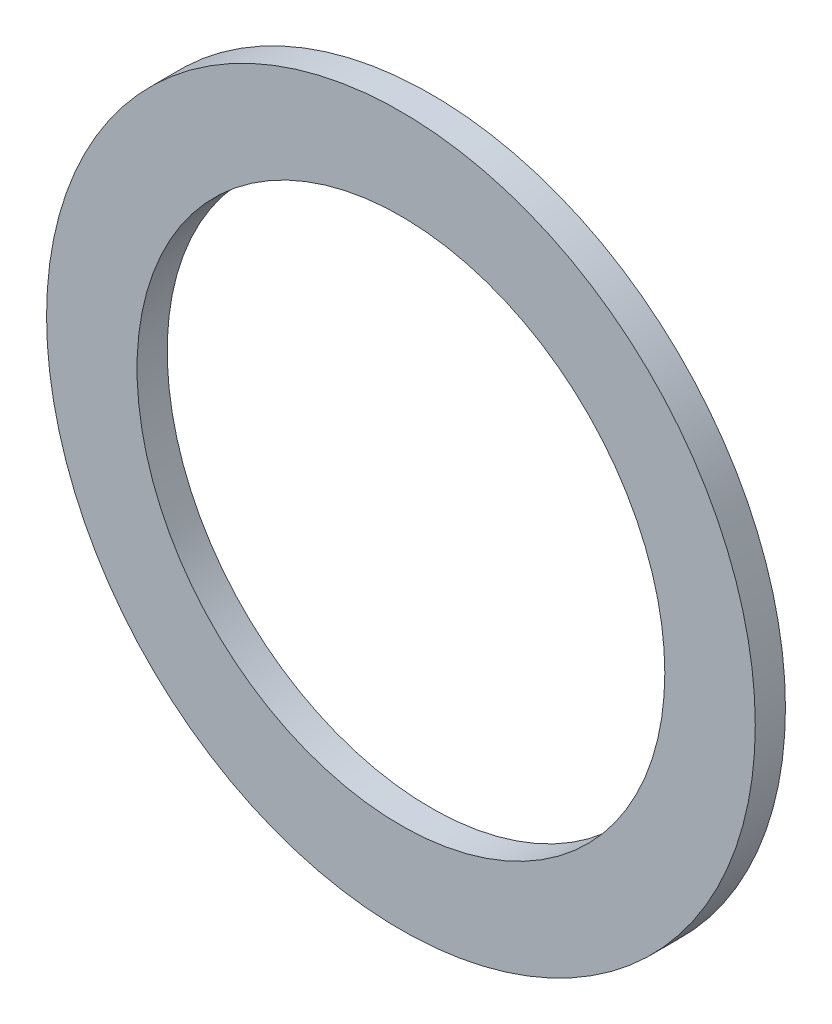
from build123d import *

# Parameters (mm, degrees)
SKETCH1_R           = 23.5
SKETCH1_R_2         = 17.5
BOSS_EXTRUDE1_DEPTH = 2


with BuildPart() as part:
    # Sketch1 → Boss-Extrude1 (new body)
    with BuildSketch(Plane.XY):
        Circle(SKETCH1_R)
        Circle(SKETCH1_R_2, mode=Mode.SUBTRACT)
    extrude(amount=BOSS_EXTRUDE1_DEPTH)


solid = part.part
